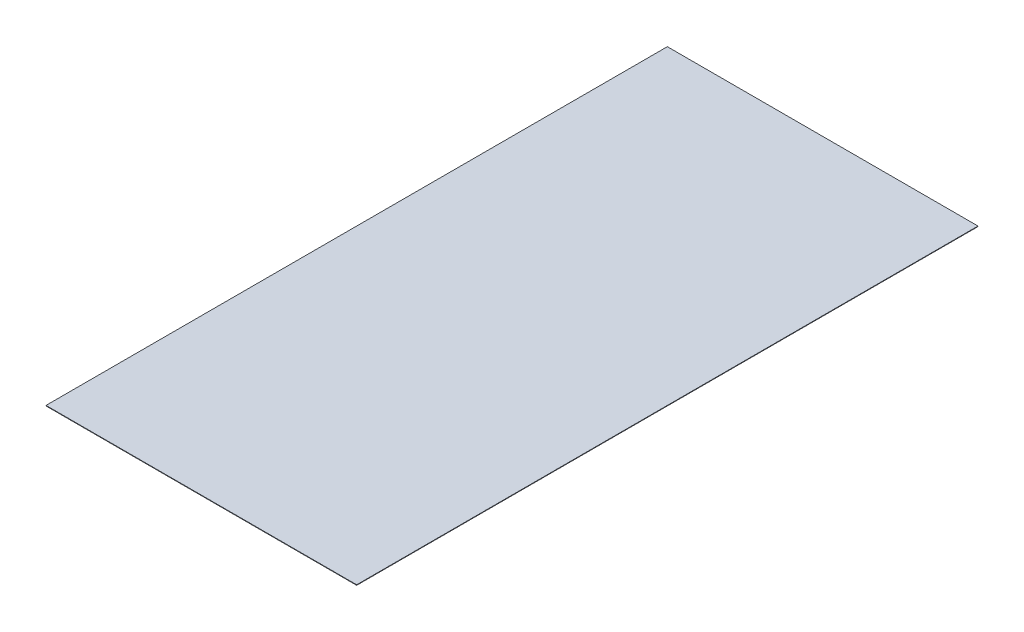
from build123d import *

# Parameters (mm, degrees)
CROQUIS1_W              = 1219.2
CROQUIS1_H              = 2438.4
SALIENTE_EXTRUIR1_DEPTH = 1.9


with BuildPart() as part:
    # Croquis1 → Saliente-Extruir1 (new body)
    with BuildSketch(Plane(origin=(0, 0, 0), x_dir=(1, 0, 0), z_dir=(0, 1, 0))):
        Rectangle(CROQUIS1_W, CROQUIS1_H)
    extrude(amount=SALIENTE_EXTRUIR1_DEPTH)


solid = part.part
